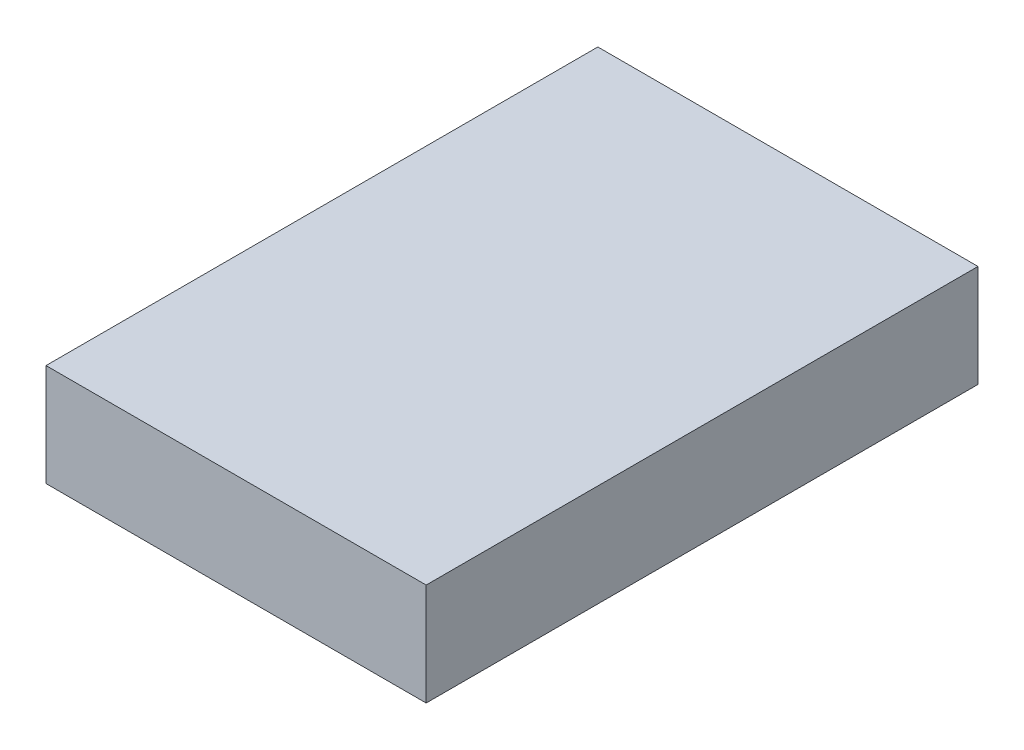
from build123d import *

# Parameters (mm, degrees)
SKETCH1_W           = 7.44
SKETCH1_H           = 10.8
BOSS_EXTRUDE1_DEPTH = 2


with BuildPart() as part:
    # Sketch1 → Boss-Extrude1 (new body)
    with BuildSketch(Plane(origin=(0, 0, 0), x_dir=(1, 0, 0), z_dir=(0, 1, 0))):
        with Locations((3.72, 5.4)):
            Rectangle(SKETCH1_W, SKETCH1_H)
    extrude(amount=BOSS_EXTRUDE1_DEPTH)


solid = part.part
